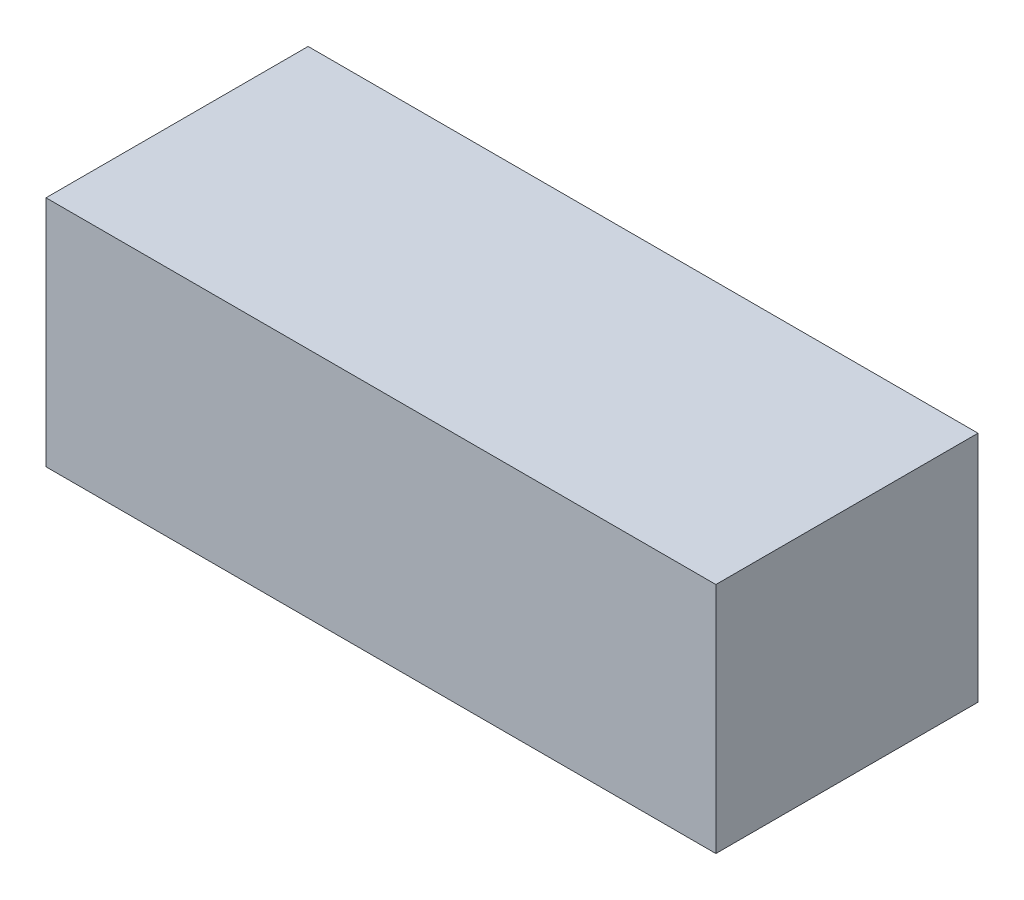
from build123d import *

# Parameters (mm, degrees)
SKETCH_1_W      = 46
SKETCH_1_H      = 18
EXTRUDE_1_DEPTH = 16


with BuildPart() as part:
    # 草图1 → 凸台-拉伸1 (new body)
    with BuildSketch(Plane(origin=(0, 0, 0), x_dir=(1, 0, 0), z_dir=(0, 1, 0))):
        Rectangle(SKETCH_1_W, SKETCH_1_H)
    extrude(amount=EXTRUDE_1_DEPTH)


solid = part.part
